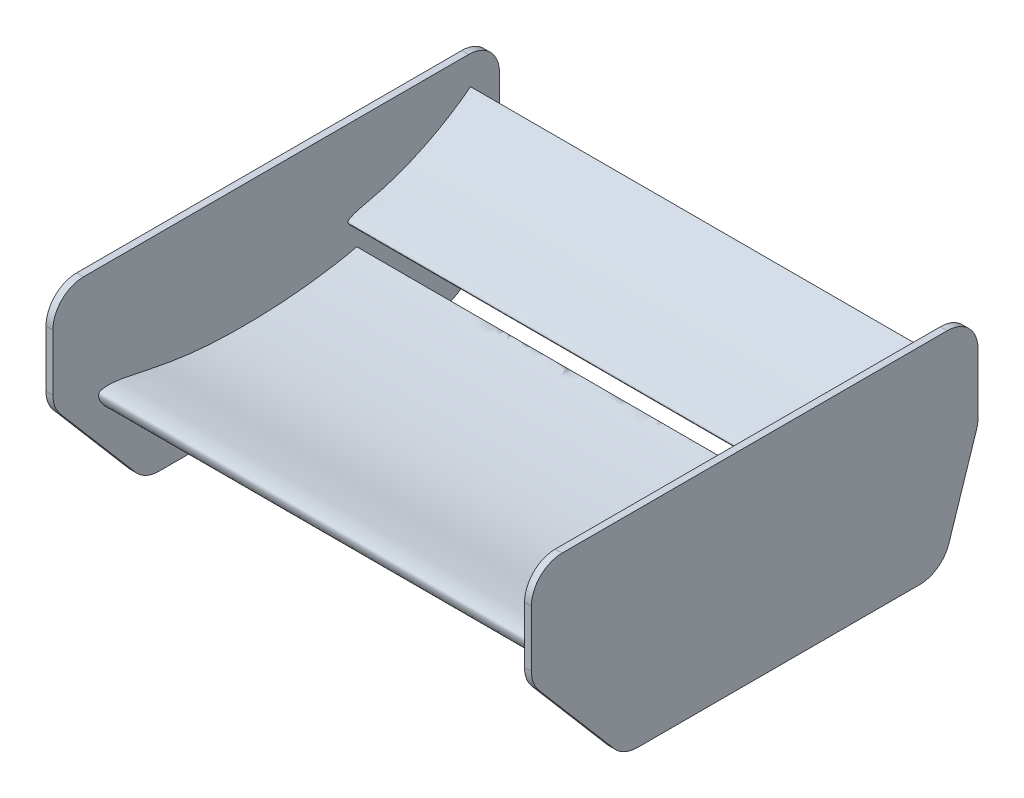
from build123d import *

# Parameters (mm, degrees)
EXTRUDED_AIRFOILS_DEPTH   = 487.449999952
EXTRUDED_AIRFOILS_2_DEPTH = 487.449999952
EXTRUDED_ENDPLATE_DEPTH   = 14.200000048


with BuildPart() as part:
    # Airfoils Sketch → Extruded Airfoils (new body)
    with BuildSketch(Plane(origin=(0, 0, 0), x_dir=(0, 0, -1), z_dir=(1, 0, 0))):
        with BuildLine():
            add(Edge.make_bspline(
                [(897.989632302, 946.000000046), (898.000513914, 945.951839281), (894.184279323, 944.352851316), (890.699819702, 942.296180156), (882.791939538, 937.933635623), (873.645939793, 932.954112993), (861.849234489, 927.640797519), (847.825954561, 922.30857822), (831.530849272, 916.634932924), (813.2008765, 910.647350929), (793.094311676, 904.422943815), (771.513904823, 898.06413618), (748.758616882, 891.715468852), (725.138031005, 885.514054628), (700.954405569, 879.629236447), (676.498467134, 874.257660211), (652.057841056, 869.565934163), (627.831804234, 865.795405193), (603.922786486, 863.282964935), (580.420628735, 862.073173574), (557.409835441, 862.139402028), (535.014387038, 863.428748658), (513.364868859, 865.878949834), (492.614715532, 869.402461043), (472.917623861, 873.841507376), (454.449730598, 879.083530955), (437.385501316, 885.029883679), (421.874189905, 891.561628897), (408.048549489, 898.559233256), (396.013645082, 905.891109977), (385.858554918, 913.416953036), (377.637446771, 920.978739297), (371.3813299, 928.395891647), (367.105151877, 935.48676691), (364.93961271, 941.592944474), (364.478646936, 945.808092476), (364.72423345, 948.022458751), (364.958745374, 949.103505513), (365.207345688, 949.805698607), (365.433998761, 950.327271857), (365.635213878, 950.682005569), (365.862098213, 951.012091726), (366.146275406, 951.304038649), (366.468830129, 951.577773117), (366.958374644, 951.951982083), (367.677617136, 952.372493507), (368.829149529, 952.929808373), (370.247862327, 953.455636597), (373.990203501, 954.551133318), (380.956406634, 955.316418787), (391.975654885, 955.164476466), (405.835940211, 953.699088451), (422.612261866, 950.928158747), (442.470944413, 946.830199159), (465.539283336, 941.749563758), (491.828789906, 936.399518652), (521.027342465, 931.264471412), (552.59555029, 926.799070536), (585.816105194, 923.592309215), (619.824369214, 921.766444825), (653.851796059, 920.998850705), (687.331665883, 921.160230805), (719.756890506, 922.202805035), (750.588370802, 924.122270917), (779.304150897, 926.732212739), (805.469395405, 929.729342209), (828.782042195, 932.897265457), (848.904387076, 936.025543084), (865.887900109, 938.991006858), (878.885329483, 941.41974614), (889.414050412, 943.814205441), (893.791195704, 944.72287816), (897.978579692, 946.048917629), (897.989632302, 946.000000046)],
                knots=[0, 0, 0, 0, 0.001812691, 0.006911328, 0.014576348, 0.024172143, 0.035572242, 0.04901308, 0.064512615, 0.081849281, 0.100772139, 0.120997345, 0.142228397, 0.164173399, 0.186536734, 0.209022727, 0.231367049, 0.253319655, 0.274803883, 0.295858285, 0.316448578, 0.336530716, 0.35603337, 0.374893008, 0.392989986, 0.410197087, 0.426388181, 0.441458696, 0.455334222, 0.467938119, 0.479235883, 0.48920359, 0.497850586, 0.505193934, 0.511308341, 0.515097163, 0.516441428, 0.517272652, 0.518060388, 0.518436362, 0.518797413, 0.519153544, 0.519507976, 0.519886846, 0.520288641, 0.521160208, 0.522116283, 0.523720315, 0.52521352, 0.532574604, 0.542380648, 0.554776211, 0.56993128, 0.588004893, 0.609187965, 0.63332852, 0.660001247, 0.688743434, 0.718873444, 0.749542513, 0.780126844, 0.81020899, 0.839387288, 0.867183376, 0.893104481, 0.916760447, 0.937874173, 0.956198632, 0.971543675, 0.983762849, 0.992691516, 0.998158824, 1, 1, 1, 1], degree=3))
        make_face()
    extrude(amount=EXTRUDED_AIRFOILS_DEPTH)



with BuildPart() as body_2:
    # Airfoils Sketch → Extruded Airfoils 2 (new body)
    with BuildSketch(Plane(origin=(0, 0, 0), x_dir=(0, 0, -1), z_dir=(1, 0, 0))):
        with BuildLine():
            add(Edge.make_bspline(
                [(1133.247895197, 1114.879542376), (1133.263722473, 1114.859087767), (1131.806001628, 1113.25519051), (1130.607103196, 1111.507461609), (1127.818717185, 1107.685840221), (1124.579136733, 1103.297234833), (1120.155072018, 1098.163376496), (1114.678164398, 1092.527643798), (1108.198329078, 1086.226907711), (1100.821972353, 1079.326674016), (1092.654635701, 1071.920724909), (1083.817370556, 1064.12470491), (1074.420106224, 1056.073413691), (1064.579459073, 1047.900476053), (1054.401433329, 1039.753195997), (1043.980514589, 1031.789286322), (1033.416365688, 1024.151513447), (1022.750162563, 1016.998566842), (1011.955953794, 1010.513055004), (1001.066525449, 1004.736020325), (990.127889471, 999.673527988), (979.210614335, 995.327909586), (968.390476554, 991.698514411), (957.759696413, 988.777748272), (947.426165666, 986.524734356), (937.498419283, 984.925029416), (928.081119643, 983.970423676), (919.271451623, 983.63749458), (911.158898739, 983.898883494), (903.822468342, 984.715380277), (897.33550853, 986.040096456), (891.758716327, 987.81000449), (887.146787462, 989.946243092), (883.547028652, 992.365889283), (881.167242998, 994.785302552), (880.015293983, 996.684326263), (879.641684401, 997.789924081), (879.513701957, 998.355046525), (879.476275125, 998.743433531), (879.468413302, 999.041215906), (879.485408764, 999.254162868), (879.520046508, 999.461091263), (879.59032598, 999.662596722), (879.682856237, 999.863951825), (879.832419813, 1000.149972229), (880.080778475, 1000.5088225), (880.504074889, 1001.028314482), (881.061180809, 1001.592004847), (882.595280633, 1002.940520477), (885.732952339, 1004.845945107), (890.997784961, 1007.213160315), (897.902110048, 1009.585764522), (906.479782474, 1011.984112713), (916.814518812, 1014.434823253), (928.890520217, 1017.129551851), (942.5553547, 1020.409457485), (957.553613901, 1024.435409414), (973.528585227, 1029.303838406), (990.009352771, 1035.135567193), (1006.558380368, 1041.797229165), (1022.882234338, 1048.96552869), (1038.740496723, 1056.453629105), (1053.903013356, 1064.126592787), (1068.114808727, 1071.863036041), (1081.169360459, 1079.458915104), (1092.927377374, 1086.673988972), (1103.293364143, 1093.338660471), (1112.153586842, 1099.278269075), (1119.55974592, 1104.445736805), (1125.192396428, 1108.475998694), (1129.660659044, 1111.943485137), (1131.537478613, 1113.343836836), (1133.231819204, 1114.900318417), (1133.247895197, 1114.879542376)],
                knots=[0, 0, 0, 0, 0.001812691, 0.006911328, 0.014576348, 0.024172143, 0.035572242, 0.04901308, 0.064512615, 0.081849281, 0.100772139, 0.120997345, 0.142228397, 0.164173399, 0.186536734, 0.209022727, 0.231367049, 0.253319655, 0.274803883, 0.295858285, 0.316448578, 0.336530716, 0.35603337, 0.374893008, 0.392989986, 0.410197087, 0.426388181, 0.441458696, 0.455334222, 0.467938119, 0.479235883, 0.48920359, 0.497850586, 0.505193934, 0.511308341, 0.515097163, 0.516441428, 0.517272652, 0.518060388, 0.518436362, 0.518797413, 0.519153544, 0.519507976, 0.519886846, 0.520288641, 0.521160208, 0.522116283, 0.523720315, 0.52521352, 0.532574604, 0.542380648, 0.554776211, 0.56993128, 0.588004893, 0.609187965, 0.63332852, 0.660001247, 0.688743434, 0.718873444, 0.749542513, 0.780126844, 0.81020899, 0.839387288, 0.867183376, 0.893104481, 0.916760447, 0.937874173, 0.956198632, 0.971543675, 0.983762849, 0.992691516, 0.998158824, 1, 1, 1, 1], degree=3))
        make_face()
    extrude(amount=EXTRUDED_AIRFOILS_2_DEPTH)


with BuildPart() as part_1:
    add(part.part)

    add(body_2.part)  # Extruded Endplate merges body 2
    # Endplate Sketch → Extruded Endplate (add)
    with BuildSketch(Plane(origin=(501.65, 0, 0), x_dir=(0, 0, -1), z_dir=(1, 0, 0))):
        with BuildLine():
            Line((333.44768579, 1174.600000046), (1129.475, 1174.600000046))
            ThreePointArc((1129.475, 1174.600000046), (1174.376280605, 1156.001280651), (1192.975, 1111.100000046))
            Line((1192.975, 1111.100000046), (1192.975, 986.671665425))
            ThreePointArc((1192.975, 986.671665425), (1192.187961727, 976.704999408), (1189.846356489, 966.985393159))
            Line((1189.846356489, 966.985393159), (1132.89690026, 792.340042461))
            ThreePointArc((1132.89690026, 792.340042461), (1109.822807151, 760.634057096), (1072.525543772, 748.526314727))
            Line((1072.525543772, 748.526314727), (489.177152122, 748.526314727))
            ThreePointArc((489.177152122, 748.526314727), (462.584654451, 754.362729445), (440.880498348, 770.799099999))
            Line((440.880498348, 770.799099999), (285.151032016, 953.232285636))
            ThreePointArc((285.151032016, 953.232285636), (273.869638177, 972.488923615), (269.94768579, 994.459500364))
            Line((269.94768579, 994.459500364), (269.94768579, 1111.100000046))
            ThreePointArc((269.94768579, 1111.100000046), (288.546405185, 1156.001280651), (333.44768579, 1174.600000046))
        make_face()
    extrude(amount=-EXTRUDED_ENDPLATE_DEPTH)

    # Mirror 2: part across plane


with BuildPart() as part_2:
    add(part_1.part)
    add(part_1.part.mirror(Plane(origin=(0, 0, 0), x_dir=(0, 0, 1), z_dir=(1, 0, 0))))


solid = part_2.part
